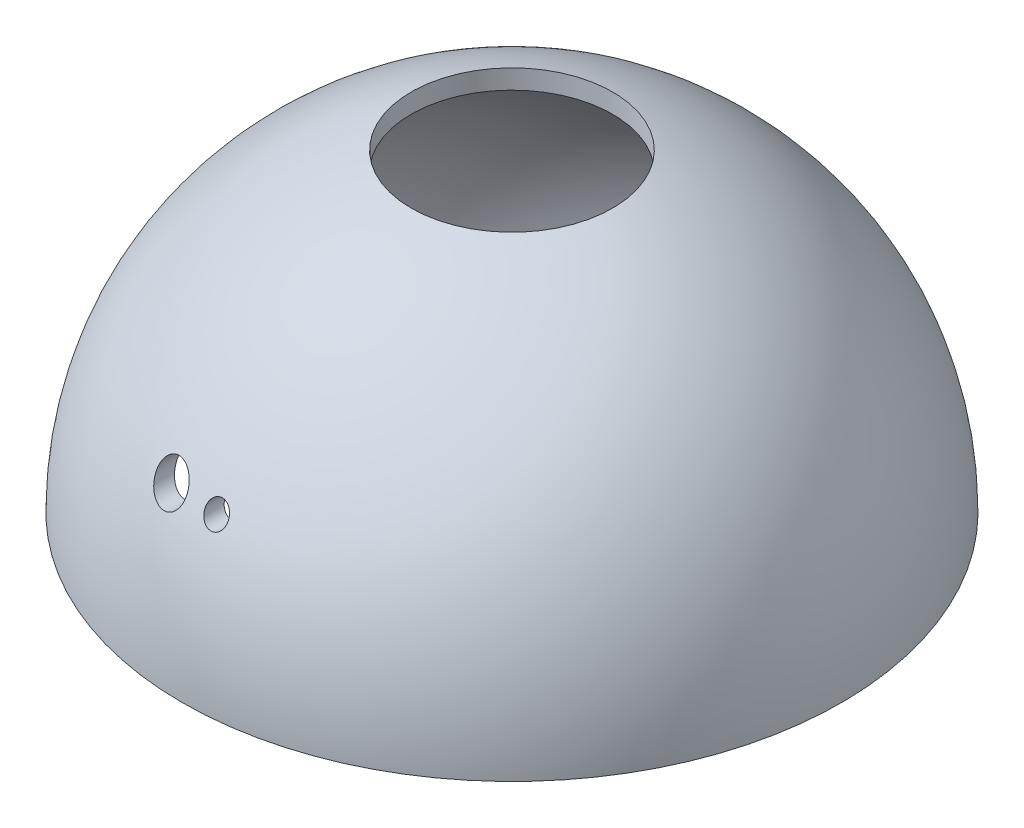
from build123d import *

# Parameters (mm, degrees)
CUT_EXTRUDE5_DEPTH      = 154.439727581
CUT_EXTRUDE5_DEPTH_BACK = 154.439727581
SKETCH7_R               = 3.15
SKETCH7_R_2             = 5


with BuildPart() as part:
    # Sketch1 → Revolve1 (revolve)
    with BuildSketch(Plane.XY, mode=Mode.PRIVATE) as revolve1_sk:
        with BuildLine():
            Line((85, 0), (90, 0))
            ThreePointArc((90, 0), (72.715197861, 53.033008589), (27.5, 85.695682505))
            Line((27.5, 85.695682505), (27.5, 80.428539711))
            ThreePointArc((27.5, 80.428539711), (69.14658343, 49.434299833), (85, 0))
        make_face()
    revolve(revolve1_sk.sketch.rotate(Axis((0, 188.683155316, 0), (0, -1, 0)), 90), axis=Axis((0, 188.683155316, 0), (0, -1, 0)))

    # Sketch7 → Cut-Extrude5 (cut, two sides: drawn at the far end of the back side and taken through both)
    with BuildSketch(Plane.XY.offset(-CUT_EXTRUDE5_DEPTH_BACK)):
        with Locations(Location((0, 39.840172705, 0), (0, 0, 269.999999991))):
            Circle(SKETCH7_R)
        with Locations(Location((-13.579797877, 39.840172705, 0), (0, 0, 207.021474241))):
            Circle(SKETCH7_R_2)
    extrude(amount=CUT_EXTRUDE5_DEPTH + CUT_EXTRUDE5_DEPTH_BACK, mode=Mode.SUBTRACT)


solid = part.part
